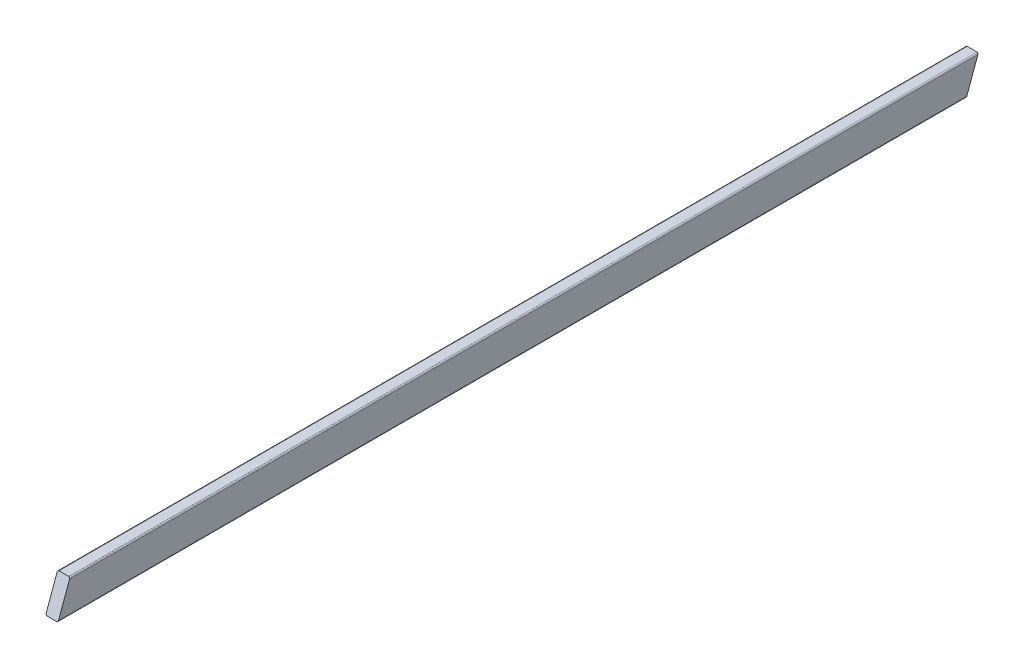
from build123d import *

# Parameters (mm, degrees)
ESBO_O1_W                = 9.525
ESBO_O1_H                = 25.4
RESSALTO_EXTRUS_O1_DEPTH = 400
ESBO_O3_OUTSIDE_W        = 962.092
ESBO_O3_OUTSIDE_H        = 187.492
CORTE_EXTRUS_O2_DEPTH    = 401.314895582
FILETE1_R                = 1


with BuildPart() as part:
    # Esboço1 → Ressalto-extrusão1 (new, symmetric)
    with BuildSketch(Plane.XY):
        Rectangle(ESBO_O1_W, ESBO_O1_H)
    extrude(amount=RESSALTO_EXTRUS_O1_DEPTH, both=True)

    # Esboço3 outside → Corte-extrusão2 (cut, through all)
    with BuildSketch(Plane(origin=(4.7625, 0, 0), x_dir=(0, 0, -1), z_dir=(1, 0, 0))):
        Rectangle(ESBO_O3_OUTSIDE_W, ESBO_O3_OUTSIDE_H)
        Polygon((-353.156605128, -12.7), (343.911761177, -12.7), (353.156605128, 12.7), (-343.911761177, 12.7), align=None, mode=Mode.SUBTRACT)
    extrude(amount=-CORTE_EXTRUS_O2_DEPTH, mode=Mode.SUBTRACT)

    # Filete1
    filete1_edges = [part.edges().sort_by_distance(p)[0] for p in [
        (4.7625, -12.7, 4.622421975),
        (-4.7625, -12.7, 4.622421975),
        (-4.7625, 12.7, -4.622421975),
        (4.7625, 12.7, -4.622421975),
    ]]
    fillet(filete1_edges, radius=FILETE1_R)


solid = part.part
